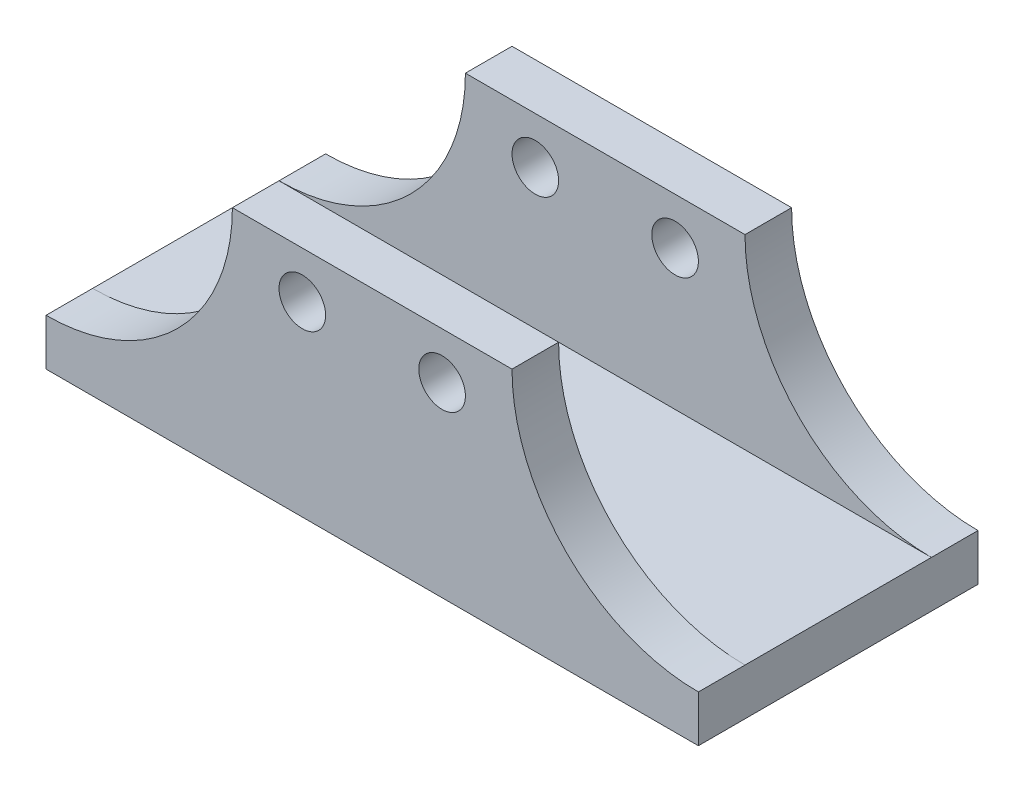
from build123d import *

# Parameters (mm, degrees)
IZIM2_R                     = 5
Y_KSEKLIK_EKSTR_ZYON2_DEPTH = 10
IZIM3_W                     = 140
IZIM3_H                     = 10
Y_KSEKLIK_EKSTR_ZYON3_DEPTH = 40
IZIM4_R                     = 5
Y_KSEKLIK_EKSTR_ZYON4_DEPTH = 10
IZIM5_R                     = 5
KES_EKSTR_ZYON1_DEPTH       = 10


with BuildPart() as part:
    # Çizim2 → Yükseklik-Ekstrüzyon2 (new body)
    with BuildSketch(Plane.XY):
        with BuildLine():
            Line((-49.137152365, 3.922510102), (-49.137152365, -6.077489898))
            Line((-49.137152365, -6.077489898), (90.862847635, -6.077489898))
            Line((90.862847635, -6.077489898), (90.862847635, 3.922510102))
            ThreePointArc((90.862847635, 3.922510102), (62.578576387, 15.638238855), (50.862847635, 43.922510102))
            Line((50.862847635, 43.922510102), (-9.137152365, 43.922510102))
            ThreePointArc((-9.137152365, 43.922510102), (-20.852881118, 15.638238855), (-49.137152365, 3.922510102))
        make_face()
        with Locations((5.862847635, 33.922510102)):
            Circle(IZIM2_R, mode=Mode.SUBTRACT)
        with Locations((35.862847635, 33.922510102)):
            Circle(IZIM2_R, mode=Mode.SUBTRACT)
    extrude(amount=Y_KSEKLIK_EKSTR_ZYON2_DEPTH)

    # Çizim3 → Yükseklik-Ekstrüzyon3 (add)
    with BuildSketch(Plane.XY.offset(10)):
        with Locations((20.862847635, -1.077489898)):
            Rectangle(IZIM3_W, IZIM3_H)
    extrude(amount=Y_KSEKLIK_EKSTR_ZYON3_DEPTH)

    # Çizim4 → Yükseklik-Ekstrüzyon4 (add)
    with BuildSketch(Plane.XY.offset(50)):
        with BuildLine():
            Line((-49.137152365, 3.922510102), (-49.137152365, -6.077489898))
            Line((-49.137152365, -6.077489898), (90.862847635, -6.077489898))
            Line((90.862847635, -6.077489898), (90.862847635, 3.922510102))
            ThreePointArc((90.862847635, 3.922510102), (62.578576387, 15.638238855), (50.862847635, 43.922510102))
            Line((50.862847635, 43.922510102), (-9.137152365, 43.922510102))
            ThreePointArc((-9.137152365, 43.922510102), (-20.852881118, 15.638238855), (-49.137152365, 3.922510102))
        make_face()
        with Locations((5.862847635, 33.922510102)):
            Circle(IZIM4_R, mode=Mode.SUBTRACT)
        with Locations((35.862847635, 33.922510102)):
            Circle(IZIM4_R, mode=Mode.SUBTRACT)
    extrude(amount=Y_KSEKLIK_EKSTR_ZYON4_DEPTH)

    # Çizim5 → Kes-Ekstrüzyon1 (cut)
    with BuildSketch(Plane(origin=(0, 3.922510102, 0), x_dir=(1, 0, 0), z_dir=(0, 1, 0))):
        with Locations(Location((20.862847635, -30, 0), (0, 0, 270))):
            Circle(IZIM5_R)
    extrude(amount=-KES_EKSTR_ZYON1_DEPTH, mode=Mode.SUBTRACT)


solid = part.part
